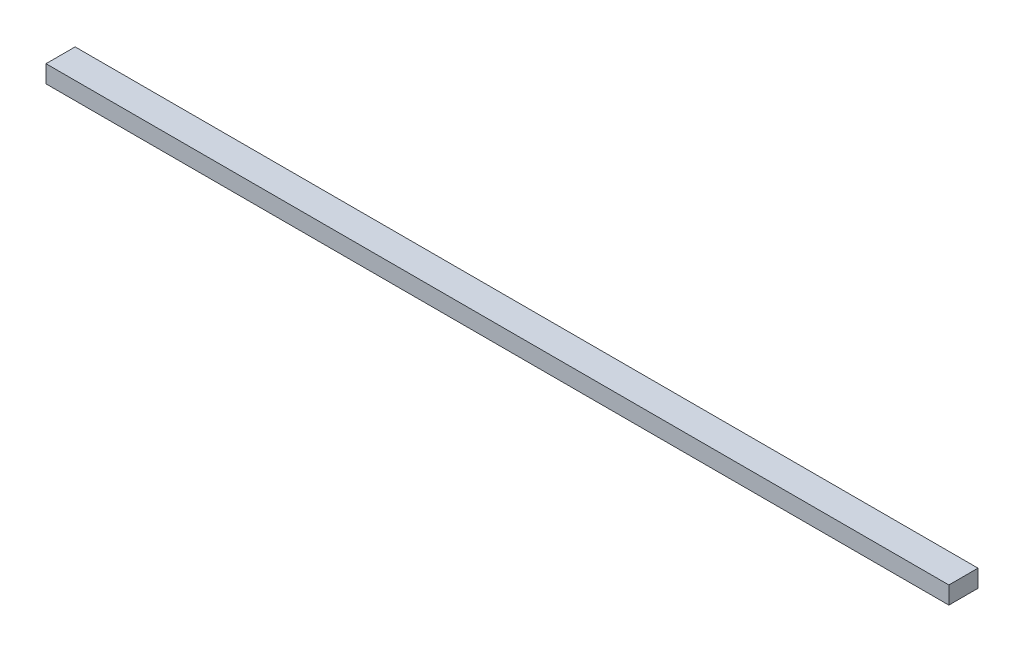
from build123d import *

# Parameters (mm, degrees)
SKETCH1_W           = 155
SKETCH1_H           = 5
BOSS_EXTRUDE1_DEPTH = 3


with BuildPart() as part:
    # Sketch1 → Boss-Extrude1 (new body)
    with BuildSketch(Plane(origin=(0, 0, 0), x_dir=(1, 0, 0), z_dir=(0, 1, 0))):
        Rectangle(SKETCH1_W, SKETCH1_H)
    extrude(amount=BOSS_EXTRUDE1_DEPTH)


solid = part.part
